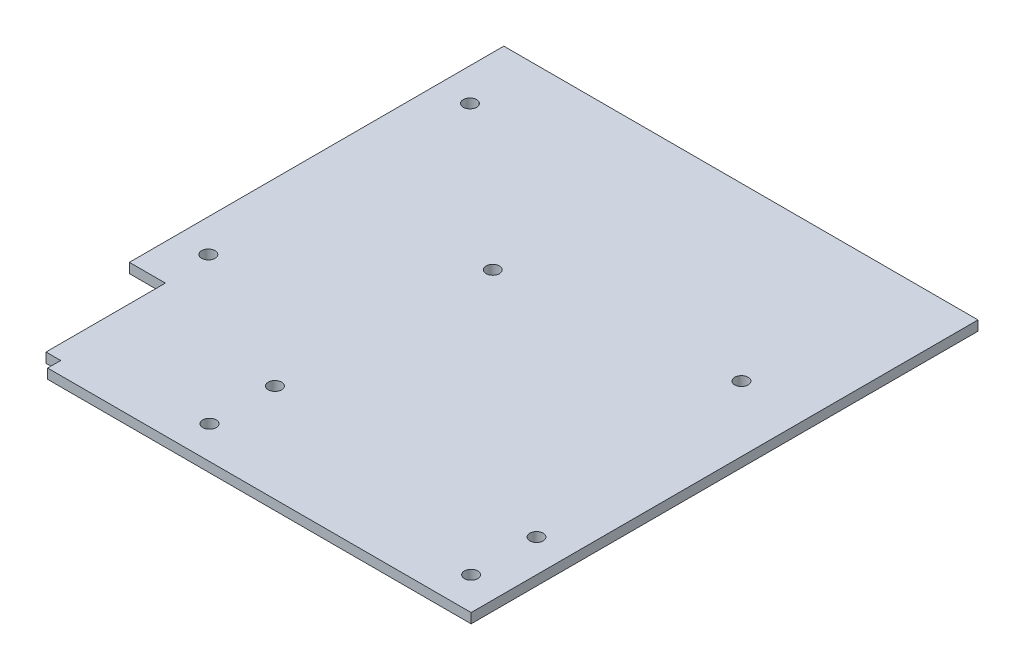
from build123d import *

# Parameters (mm, degrees)
SKETCH1_W           = 145
SKETCH1_H           = 155
BOSS_EXTRUDE1_DEPTH = 3
SKETCH3_W           = 4.5
SKETCH3_H           = 4
CUT_EXTRUDE1_DEPTH  = 3
SKETCH4_R           = 2.05
CUT_EXTRUDE2_DEPTH  = 3
SKETCH5_R           = 2.05
CUT_EXTRUDE3_DEPTH  = 10


with BuildPart() as part:
    # Sketch1 → Boss-Extrude1 (new body)
    with BuildSketch(Plane(origin=(0, 0, 0), x_dir=(1, 0, 0), z_dir=(0, 1, 0))):
        Rectangle(SKETCH1_W, SKETCH1_H)
    extrude(amount=BOSS_EXTRUDE1_DEPTH)

    # Sketch3 → Cut-Extrude1 (cut)
    with BuildSketch(Plane(origin=(0, 3, 0), x_dir=(1, 0, 0), z_dir=(0, 1, 0))):
        Polygon((-61.5, -37), (-72.5, -37), (-72.5, -77.5), (-61.5, -77.5), (-61.5, -73.5), align=None)
        with Locations((-59.25, -75.5)):
            Rectangle(SKETCH3_W, SKETCH3_H)
    extrude(amount=-CUT_EXTRUDE1_DEPTH, mode=Mode.SUBTRACT)

    # Sketch4 → Cut-Extrude2 (cut)
    with BuildSketch(Plane(origin=(0, 3, 0), x_dir=(1, 0, 0), z_dir=(0, 1, 0))):
        with Locations(Location((-17.5, -67.5, 0), (0, 0, 270))):
            Circle(SKETCH4_R)
        with Locations(Location((62.5, -67.5, 0), (0, 0, 270))):
            Circle(SKETCH4_R)
        with Locations(Location((-62.5, -22.85, 0), (0, 0, 270))):
            Circle(SKETCH4_R)
        with Locations(Location((-62.5, 57.15, 0), (0, 0, 270))):
            Circle(SKETCH4_R)
        with Locations(Location((62.5, -47.5, 0), (0, 0, 270))):
            Circle(SKETCH4_R)
        with Locations(Location((-17.5, -47.5, 0), (0, 0, 270))):
            Circle(SKETCH4_R)
    extrude(amount=-CUT_EXTRUDE2_DEPTH, mode=Mode.SUBTRACT)

    # Sketch5 → Cut-Extrude3 (cut)
    with BuildSketch(Plane(origin=(0, 3, 0), x_dir=(1, 0, 0), z_dir=(0, 1, 0))):
        with Locations(Location((52.538287268, 25.128851924, 0), (0, 0, 270))):
            Circle(SKETCH5_R)
        with Locations(Location((-14.95509898, 16.575946892, 0), (0, 0, 270))):
            Circle(SKETCH5_R)
    extrude(amount=-CUT_EXTRUDE3_DEPTH, mode=Mode.SUBTRACT)


solid = part.part
